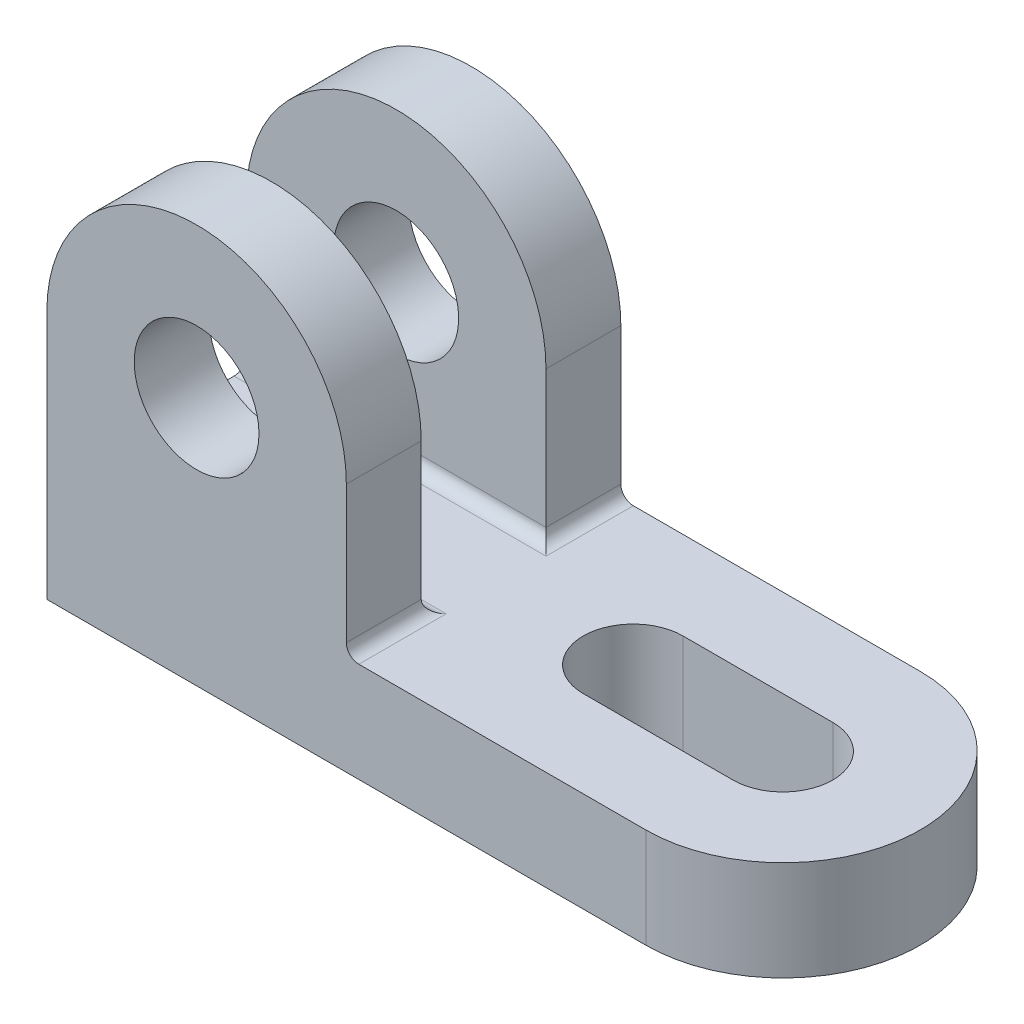
from build123d import *

# Parameters (mm, degrees)
BOSS_EXTRUDE1_DEPTH = 16
CUT_EXTRUDE1_DEPTH  = 16
BOSS_EXTRUDE2_DEPTH = 12
BOSS_EXTRUDE4_START = -12
SKETCH8_R           = 10
BOSS_EXTRUDE4_DEPTH = 12
FILLET1_R           = 2


with BuildPart() as part:
    # Sketch1 → Boss-Extrude1 (new body)
    with BuildSketch(Plane(origin=(0, 0, 0), x_dir=(1, 0, 0), z_dir=(0, 1, 0))):
        with BuildLine():
            Line((0, 0), (96, 0))
            ThreePointArc((96, 0), (118, 22), (96, 44))
            Line((96, 44), (0, 44))
            Line((0, 44), (0, 0))
        make_face()
    extrude(amount=BOSS_EXTRUDE1_DEPTH)

    # Sketch2 → Cut-Extrude1 (cut)
    with BuildSketch(Plane(origin=(0, 16, 0), x_dir=(1, 0, 0), z_dir=(0, 1, 0))):
        with BuildLine():
            Line((96.055741544, 29.909588047), (72.055741544, 29.909588047))
            ThreePointArc((72.055741544, 29.909588047), (64.055741544, 21.909588047), (72.055741544, 13.909588047))
            Line((72.055741544, 13.909588047), (96.055741544, 13.909588047))
            ThreePointArc((96.055741544, 13.909588047), (104.055741544, 21.909588047), (96.055741544, 29.909588047))
        make_face()
    extrude(amount=-CUT_EXTRUDE1_DEPTH, mode=Mode.SUBTRACT)

    # Sketch3 → Boss-Extrude2 (add)
    with BuildSketch(Plane.XY):
        with BuildLine():
            ThreePointArc((0, 40), (7.029437263, 23.02943724), (24.000000033, 16))
            ThreePointArc((24.000000033, 16), (40.97056276, 23.029437263), (48, 40))
            Line((48, 40), (34, 40))
            ThreePointArc((34, 40), (24, 30), (14, 40))
            Line((14, 40), (0, 40))
        make_face()
        with BuildLine():
            ThreePointArc((48, 40), (24, 64), (0, 40))
            Line((0, 40), (14, 40))
            ThreePointArc((14, 40), (24, 50), (34, 40))
            Line((34, 40), (48, 40))
        make_face()
        with BuildLine():
            ThreePointArc((48, 40), (40.97056276, 23.029437263), (24.000000033, 16))
            Line((24.000000033, 16), (48, 16))
            Line((48, 16), (48, 40))
        make_face()
        with BuildLine():
            Line((0, 40), (0, 16))
            Line((0, 16), (24.000000033, 16))
            ThreePointArc((24.000000033, 16), (7.029437263, 23.02943724), (0, 40))
        make_face()
    extrude(amount=-BOSS_EXTRUDE2_DEPTH)

    # Sketch8 → Boss-Extrude4 (add)
    with BuildSketch(Plane(origin=(0, 0, -44), x_dir=(-1, 0, 0), z_dir=(0, 0, -1)).offset(BOSS_EXTRUDE4_START)):
        with BuildLine():
            Line((0, 16), (-48, 16))
            Line((-48, 16), (-48, 40))
            ThreePointArc((-48, 40), (-24, 64), (0, 40))
            Line((0, 40), (0, 16))
        make_face()
        with Locations(Location((-24, 40, 0), (0, 0, 180))):
            Circle(SKETCH8_R, mode=Mode.SUBTRACT)
    extrude(amount=BOSS_EXTRUDE4_DEPTH)

    # Fillet1
    fillet1_edges = [part.edges().sort_by_distance(p)[0] for p in [
        (48, 16, -6),
        (24, 16, -12),
        (24, 16, -32),
        (48, 16, -38),
    ]]
    fillet(fillet1_edges, radius=FILLET1_R)


solid = part.part
